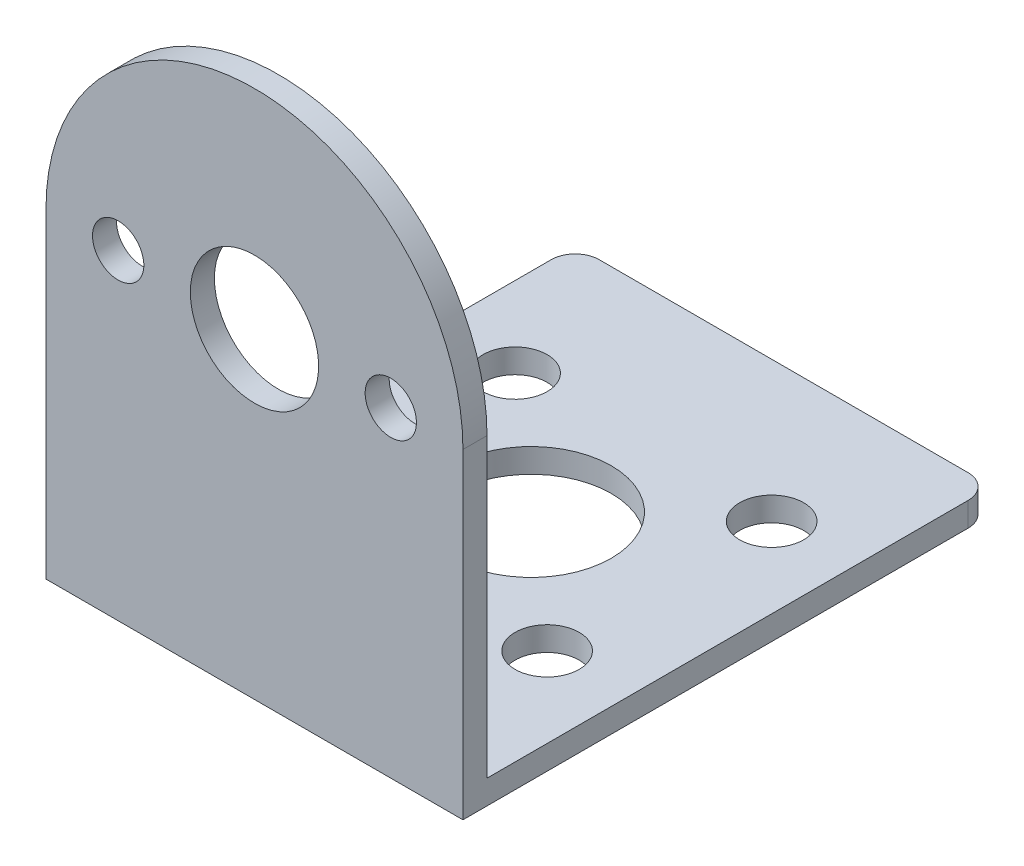
from build123d import *

# Parameters (mm, degrees)
BOSS_EXTRUDE1_DEPTH = 1.5
SKETCH2_R           = 4
SKETCH2_R_2         = 1.6
CUT_EXTRUDE1_DEPTH  = 43.038672672
SKETCH3_W           = 26
SKETCH3_H           = 1.5
BOSS_EXTRUDE4_DEPTH = 31.5
SKETCH4_R           = 5
SKETCH4_R_2         = 2
CUT_EXTRUDE2_DEPTH  = 53.509522946
FILLET1_R           = 1.5


with BuildPart() as part:
    # Sketch1 → Boss-Extrude1 (new body)
    with BuildSketch(Plane.XY):
        with BuildLine():
            Line((0, 0), (26, 0))
            Line((26, 0), (26, 20))
            ThreePointArc((26, 20), (13, 33), (0, 20))
            Line((0, 20), (0, 0))
        make_face()
    extrude(amount=BOSS_EXTRUDE1_DEPTH)

    # Sketch2 → Cut-Extrude1 (cut, through all)
    with BuildSketch(Plane(origin=(0, 0, 0), x_dir=(-1, 0, 0), z_dir=(0, 0, -1))):
        with Locations((-13, 20)):
            Circle(SKETCH2_R)
        with Locations((-21.5, 20)):
            Circle(SKETCH2_R_2)
        with Locations((-4.5, 20)):
            Circle(SKETCH2_R_2)
    extrude(amount=-CUT_EXTRUDE1_DEPTH, mode=Mode.SUBTRACT)

    # Sketch3 → Boss-Extrude4 (add)
    with BuildSketch(Plane(origin=(0, 0, 0), x_dir=(-1, 0, 0), z_dir=(0, 0, -1))):
        with Locations((-13, 0.75)):
            Rectangle(SKETCH3_W, SKETCH3_H)
    extrude(amount=BOSS_EXTRUDE4_DEPTH)

    # Sketch4 → Cut-Extrude2 (cut, through all)
    with BuildSketch(Plane.XZ):
        with Locations(Location((13, -15.75, 0), (0, 0, 270))):
            Circle(SKETCH4_R)
        with Locations(Location((5, -8.75, 0), (0, 0, 270))):
            Circle(SKETCH4_R_2)
        with Locations(Location((21, -8.75, 0), (0, 0, 270))):
            Circle(SKETCH4_R_2)
        with Locations((21, -22.75)):
            Circle(SKETCH4_R_2)
        with Locations((5, -22.75)):
            Circle(SKETCH4_R_2)
    extrude(amount=-CUT_EXTRUDE2_DEPTH, mode=Mode.SUBTRACT)

    # Fillet1
    fillet1_edges = [part.edges().sort_by_distance(p)[0] for p in [
        (26, 0.75, -31.5),
        (0, 0.75, -31.5),
    ]]
    fillet(fillet1_edges, radius=FILLET1_R)


solid = part.part
